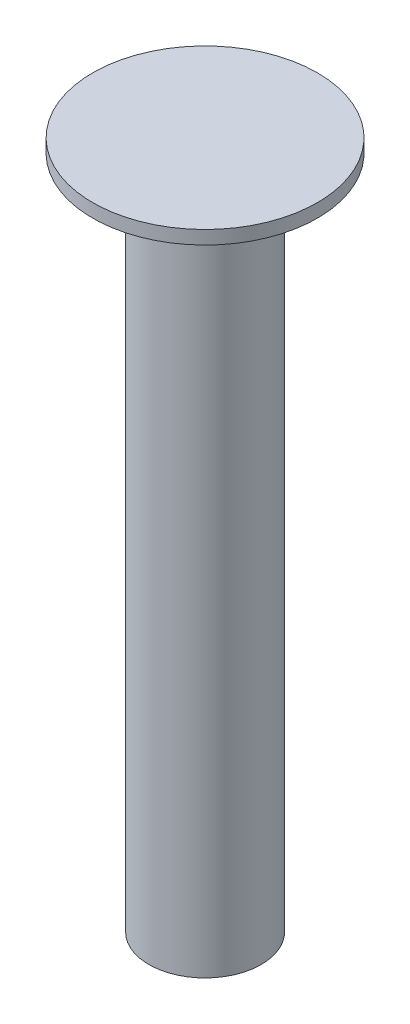
from build123d import *

# Parameters (mm, degrees)
SKETCH1_R           = 6.35
BOSS_EXTRUDE1_DEPTH = 76.2
SKETCH2_R           = 12.7
BOSS_EXTRUDE2_DEPTH = 1.524


with BuildPart() as part:
    # Sketch1 → Boss-Extrude1 (new body)
    with BuildSketch(Plane(origin=(0, 0, 0), x_dir=(1, 0, 0), z_dir=(0, 1, 0))):
        with Locations(Location((0, 0, 0), (0, 0, 90))):
            Circle(SKETCH1_R)
    extrude(amount=BOSS_EXTRUDE1_DEPTH)

    # Sketch2 → Boss-Extrude2 (add)
    with BuildSketch(Plane(origin=(0, 76.2, 0), x_dir=(1, 0, 0), z_dir=(0, 1, 0))):
        with Locations(Location((0, 0, 0), (0, 0, 90))):
            Circle(SKETCH2_R)
    extrude(amount=BOSS_EXTRUDE2_DEPTH)


solid = part.part
